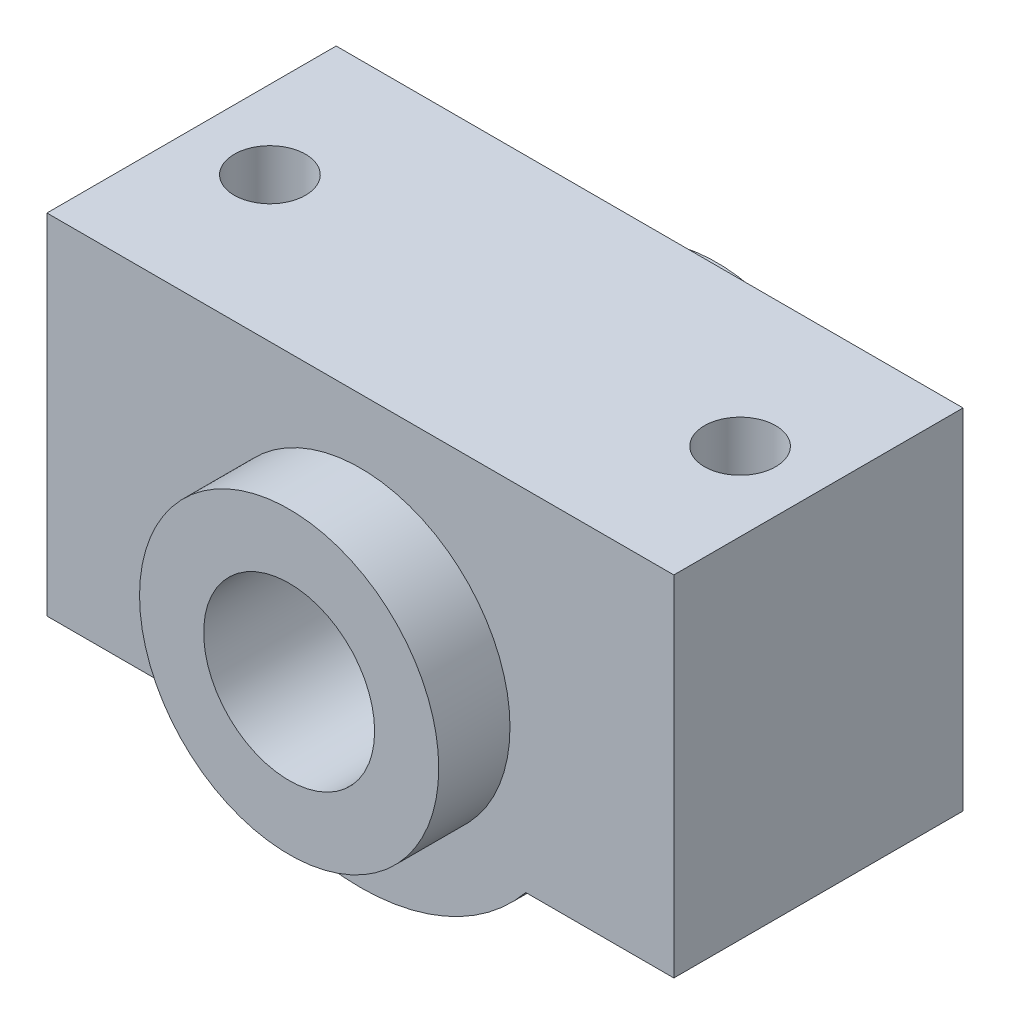
from build123d import *

# Parameters (mm, degrees)
IZIM1_R                          = 6
Y_KSEKLIK_EKSTR_ZYON1_DEPTH      = 20.3
Y_KSEKLIK_EKSTR_ZYON2_DEPTH      = 5
Y_KSEKLIK_EKSTR_ZYON2_DEPTH_BACK = 25
IZIM2_R                          = 10.5
IZIM2_R_2                        = 6
IZIM5_R                          = 2.5
KES_EKSTR_ZYON1_DEPTH            = 45.989887753


with BuildPart() as part:
    # Çizim1 → Yükseklik-Ekstrüzyon1 (new body)
    with BuildSketch(Plane.XY):
        with BuildLine():
            Line((-22, -9.5), (-11.608186766, -9.5))
            ThreePointArc((-11.608186766, -9.5), (0, -15), (11.608186766, -9.5))
            Line((11.608186766, -9.5), (22, -9.5))
            Line((22, -9.5), (22, 15))
            Line((22, 15), (-22, 15))
            Line((-22, 15), (-22, -9.5))
        make_face()
        Circle(IZIM1_R, mode=Mode.SUBTRACT)
    extrude(amount=Y_KSEKLIK_EKSTR_ZYON1_DEPTH)

    # Çizim2 → Yükseklik-Ekstrüzyon2 (add, two sides: drawn at the far end of the back side and taken through both)
    with BuildSketch(Plane.XY.offset(20.3).offset(-Y_KSEKLIK_EKSTR_ZYON2_DEPTH_BACK)):
        Circle(IZIM2_R)
        Circle(IZIM2_R_2, mode=Mode.SUBTRACT)
    extrude(amount=Y_KSEKLIK_EKSTR_ZYON2_DEPTH + Y_KSEKLIK_EKSTR_ZYON2_DEPTH_BACK)

    # Çizim5 → Kes-Ekstrüzyon1 (cut, through all)
    with BuildSketch(Plane(origin=(0, 15, 0), x_dir=(1, 0, 0), z_dir=(0, 1, 0))):
        with Locations(Location((-16.5, -10.15, 0), (0, 0, 270))):
            Circle(IZIM5_R)
        with Locations(Location((16.5, -10.15, 0), (0, 0, 270))):
            Circle(IZIM5_R)
    extrude(amount=-KES_EKSTR_ZYON1_DEPTH, mode=Mode.SUBTRACT)


solid = part.part
